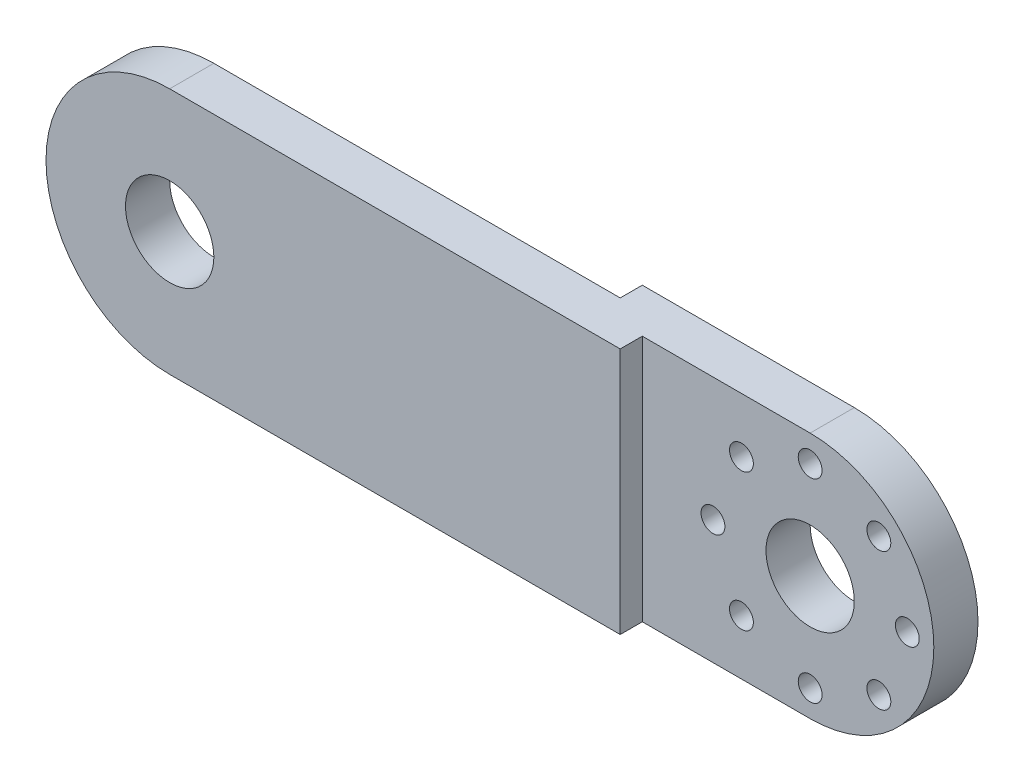
from build123d import *

# Parameters (mm, degrees)
RESSALTO_EXTRUS_O1_DEPTH   = 5
ESBO_O2_R                  = 1.35
ESBO_O2_R_2                = 1.373066436
ESBO_O2_R_3                = 1.330065432
ESBO_O2_R_4                = 5
CORTE_EXTRUS_O1_DEPTH      = 137.810087347
ESBO_O3_R                  = 5
CORTE_EXTRUS_O2_DEPTH      = 137.810087347
ESBO_O5_W                  = 31.24115408
ESBO_O5_H                  = 28
CORTE_EXTRUS_O3_DEPTH      = 137.810087347
ESBO_O6_W                  = 5
ESBO_O6_H                  = 28
RESSALTO_EXTRUS_O2_DEPTH   = 2.5
RESSALTO_EXTRUS_O4_DEPTH   = 5
ESBO_O8_R                  = 5
ESBO_O8_R_2                = 1.35
CORTE_EXTRUS_O4_DEPTH      = 135.937948702
ESBO_O10_W                 = 5
ESBO_O10_H                 = 2.5
CORTE_EXTRUS_O5_DEPTH      = 137.985400682
ESBO_O11_W                 = 5
ESBO_O11_H                 = 2.5
RESSALTO_EXTRUS_O5_DEPTH   = 28
ESBO_O14_W                 = 51.545841804
ESBO_O14_H                 = 28
CORTE_EXTRUS_O6_DEPTH      = 10
CORTE_EXTRUS_O7_DEPTH      = 135.822105012
CORTE_EXTRUS_O7_DEPTH_BACK = 10
ESBO_O16_R                 = 5
CORTE_EXTRUS_O8_DEPTH      = 10


with BuildPart() as part:
    # Esboço1 → Ressalto-extrusão1 (new body)
    with BuildSketch(Plane.XY):
        with BuildLine():
            Line((0, -14), (122, -14))
            ThreePointArc((122, -14), (136, 0), (122, 14))
            Line((122, 14), (0, 14))
            ThreePointArc((0, 14), (-14, 0), (0, -14))
        make_face()
    extrude(amount=RESSALTO_EXTRUS_O1_DEPTH)

    # Esboço2 → Corte-extrusão1 (cut, through all)
    with BuildSketch(Plane(origin=(0, 0, 0), x_dir=(-1, 0, 0), z_dir=(0, 0, -1))):
        with Locations((-125.327123404, 10.484762747)):
            Circle(ESBO_O2_R)
        with Locations((-116.938784683, 9.766478358)):
            Circle(ESBO_O2_R)
        with Locations((-111.515237253, 3.327123404)):
            Circle(ESBO_O2_R)
        with Locations((-112.233521642, -5.061215317)):
            Circle(ESBO_O2_R)
        with Locations((-118.672876596, -10.484762747)):
            Circle(ESBO_O2_R_2)
        with Locations((-127.061215317, -9.766478358)):
            Circle(ESBO_O2_R_3)
        with Locations((-132.484762747, -3.327123404)):
            Circle(ESBO_O2_R)
        with Locations((-131.766478358, 5.061215317)):
            Circle(ESBO_O2_R)
        with Locations((-122, 0)):
            Circle(ESBO_O2_R_4)
    extrude(amount=-CORTE_EXTRUS_O1_DEPTH, mode=Mode.SUBTRACT)

    # Esboço3 → Corte-extrusão2 (cut, through all)
    with BuildSketch(Plane(origin=(0, 0, 0), x_dir=(-1, 0, 0), z_dir=(0, 0, -1))):
        Circle(ESBO_O3_R)
    extrude(amount=-CORTE_EXTRUS_O2_DEPTH, mode=Mode.SUBTRACT)

    # Esboço5 → Corte-extrusão3 (cut, through all)
    with BuildSketch(Plane(origin=(0, 0, 0), x_dir=(-1, 0, 0), z_dir=(0, 0, -1))):
        with Locations((-121.62057704, 0)):
            Rectangle(ESBO_O5_W, ESBO_O5_H)
    extrude(amount=-CORTE_EXTRUS_O3_DEPTH, mode=Mode.SUBTRACT)

    # Esboço6 → Ressalto-extrusão2 (add)
    with BuildSketch(Plane(origin=(0, 0, 0), x_dir=(-1, 0, 0), z_dir=(0, 0, -1))):
        with Locations((-103.5, 0)):
            Rectangle(ESBO_O6_W, ESBO_O6_H)
    extrude(amount=RESSALTO_EXTRUS_O2_DEPTH)

    # Esboço7 → Ressalto-extrusão4 (add)
    with BuildSketch(Plane(origin=(0, 0, -2.5), x_dir=(-1, 0, 0), z_dir=(0, 0, -1))):
        with BuildLine():
            Line((-106, 14), (-120, 14))
            ThreePointArc((-120, 14), (-134, 0), (-120, -14))
            Line((-120, -14), (-106, -14))
            Line((-106, -14), (-106, 14))
        make_face()
    extrude(amount=-RESSALTO_EXTRUS_O4_DEPTH)

    # Esboço8 → Corte-extrusão4 (cut, through all)
    with BuildSketch(Plane(origin=(0, 0, -2.5), x_dir=(-1, 0, 0), z_dir=(0, 0, -1))):
        with Locations((-120, 0)):
            Circle(ESBO_O8_R)
        with Locations((-120, 11)):
            Circle(ESBO_O8_R_2)
        with Locations((-109, 0)):
            Circle(ESBO_O8_R_2)
        with Locations((-120, -11)):
            Circle(ESBO_O8_R_2)
        with Locations((-131, 0)):
            Circle(ESBO_O8_R_2)
        with Locations((-112.221825407, 7.778174593)):
            Circle(ESBO_O8_R_2)
        with Locations((-112.221825407, -7.778174593)):
            Circle(ESBO_O8_R_2)
        with Locations((-127.778174593, -7.778174593)):
            Circle(ESBO_O8_R_2)
        with Locations((-127.778174593, 7.778174593)):
            Circle(ESBO_O8_R_2)
    extrude(amount=-CORTE_EXTRUS_O4_DEPTH, mode=Mode.SUBTRACT)

    # Esboço10 → Corte-extrusão5 (cut, through all)
    with BuildSketch(Plane.XZ.offset(14)):
        with Locations((103.5, 3.75)):
            Rectangle(ESBO_O10_W, ESBO_O10_H)
    extrude(amount=-CORTE_EXTRUS_O5_DEPTH, mode=Mode.SUBTRACT)

    # Esboço11 → Ressalto-extrusão5 (add, through all)
    with BuildSketch(Plane.XZ.offset(14)):
        with Locations((98.5, -1.25)):
            Rectangle(ESBO_O11_W, ESBO_O11_H)
    extrude(amount=-RESSALTO_EXTRUS_O5_DEPTH)

    # Esboço14 → Corte-extrusão6 (cut)
    with BuildSketch(Plane(origin=(0, 0, 0), x_dir=(-1, 0, 0), z_dir=(0, 0, -1))):
        with Locations((-10.227079098, 0)):
            Rectangle(ESBO_O14_W, ESBO_O14_H)
    extrude(amount=-CORTE_EXTRUS_O6_DEPTH, mode=Mode.SUBTRACT)

    # Esboço15 → Corte-extrusão7 (cut, two sides: drawn at the far end of the back side and taken through both)
    with BuildSketch(Plane(origin=(0, 0, 0), x_dir=(-1, 0, 0), z_dir=(0, 0, -1)).offset(-CORTE_EXTRUS_O7_DEPTH_BACK)):
        with BuildLine():
            Line((-36, 14), (-50, 14))
            ThreePointArc((-50, 14), (-40.100505063, 9.899494937), (-36, 0))
            Line((-36, 0), (-36, 14))
        make_face()
        with BuildLine():
            Line((-36, -14), (-36, 0))
            ThreePointArc((-36, 0), (-40.100505063, -9.899494937), (-50, -14))
            Line((-50, -14), (-36, -14))
        make_face()
    extrude(amount=CORTE_EXTRUS_O7_DEPTH + CORTE_EXTRUS_O7_DEPTH_BACK, mode=Mode.SUBTRACT)

    # Esboço16 → Corte-extrusão8 (cut)
    with BuildSketch(Plane(origin=(0, 0, 0), x_dir=(-1, 0, 0), z_dir=(0, 0, -1))):
        with Locations((-50, 0)):
            Circle(ESBO_O16_R)
    extrude(amount=-CORTE_EXTRUS_O8_DEPTH, mode=Mode.SUBTRACT)


solid = part.part
